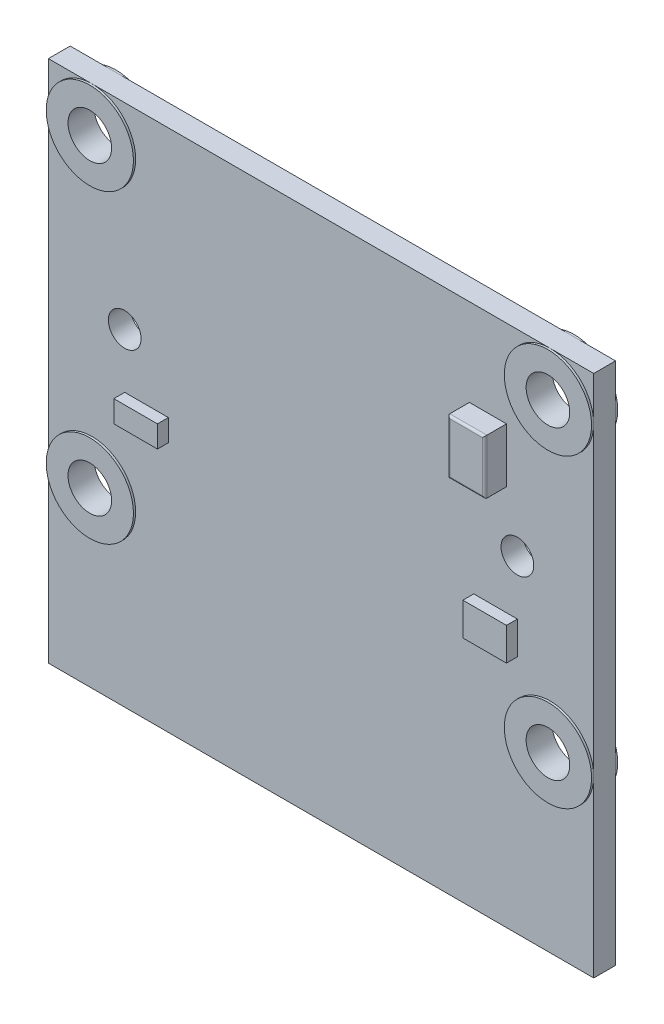
from build123d import *

# Parameters (mm, degrees)
SKETCH1_W                = 25
SKETCH1_H                = 24
BOSS_EXTRUDE1_DEPTH      = 1
SKETCH2_R                = 1
SKETCH2_R_2              = 0.75
CUT_EXTRUDE1_DEPTH       = 2
BOSS_EXTRUDE3_DEPTH      = 0.1
BOSS_EXTRUDE3_DEPTH_BACK = 1.1
SKETCH3_R                = 2
SKETCH3_R_2              = 1
SKETCH4_W                = 1.7
SKETCH4_H                = 2.5
BOSS_EXTRUDE4_DEPTH      = 1
FILLET1_R                = 0.1
SKETCH5_W                = 2
SKETCH5_H                = 1
SKETCH5_H_2              = 1.5
BOSS_EXTRUDE5_DEPTH      = 0.5


with BuildPart() as part:
    # Sketch1 → Boss-Extrude1 (new body)
    with BuildSketch(Plane.XY):
        Rectangle(SKETCH1_W, SKETCH1_H)
    extrude(amount=BOSS_EXTRUDE1_DEPTH)

    # Sketch2 → Cut-Extrude1 (cut)
    with BuildSketch(Plane.XY.offset(1)):
        with Locations((-10.5, 10)):
            Circle(SKETCH2_R)
        with Locations((10.5, 10)):
            Circle(SKETCH2_R)
        with Locations((10.5, -4)):
            Circle(SKETCH2_R)
        with Locations((-10.5, -4)):
            Circle(SKETCH2_R)
        with Locations((-9, 3)):
            Circle(SKETCH2_R_2)
        with Locations((9, 3)):
            Circle(SKETCH2_R_2)
    extrude(amount=-CUT_EXTRUDE1_DEPTH, mode=Mode.SUBTRACT)

    # Sketch3 → Boss-Extrude3 (add, two sides: drawn at the far end of the back side and taken through both)
    # profile 1 of 4: a face of its own
    with BuildSketch(Plane.XY.offset(1).offset(-BOSS_EXTRUDE3_DEPTH_BACK)):
        with Locations((-10.5, 10)):
            Circle(SKETCH3_R)
        with Locations((-10.5, 10)):
            Circle(SKETCH3_R_2, mode=Mode.SUBTRACT)
    # profile 2 of 4: a face of its own
    with BuildSketch(Plane.XY.offset(1).offset(-BOSS_EXTRUDE3_DEPTH_BACK)):
        with Locations((10.5, 10)):
            Circle(SKETCH3_R)
        with Locations((10.5, 10)):
            Circle(SKETCH3_R_2, mode=Mode.SUBTRACT)
    # profile 3 of 4: a face of its own
    with BuildSketch(Plane.XY.offset(1).offset(-BOSS_EXTRUDE3_DEPTH_BACK)):
        with Locations((10.5, -4)):
            Circle(SKETCH3_R)
        with Locations((10.5, -4)):
            Circle(SKETCH3_R_2, mode=Mode.SUBTRACT)
    # profile 4 of 4: a face of its own
    with BuildSketch(Plane.XY.offset(1).offset(-BOSS_EXTRUDE3_DEPTH_BACK)):
        with Locations((-10.5, -4)):
            Circle(SKETCH3_R)
        with Locations((-10.5, -4)):
            Circle(SKETCH3_R_2, mode=Mode.SUBTRACT)
    extrude(amount=BOSS_EXTRUDE3_DEPTH + BOSS_EXTRUDE3_DEPTH_BACK)

    # Sketch4 → Boss-Extrude4 (add)
    with BuildSketch(Plane.XY.offset(1)):
        with Locations((7.65, 6.75)):
            Rectangle(SKETCH4_W, SKETCH4_H)
    extrude(amount=BOSS_EXTRUDE4_DEPTH)

    # Fillet1
    fillet1_edges = [part.edges().sort_by_distance(p)[0] for p in [
        (8.5, 6.75, 2),
        (7.65, 8, 2),
        (6.8, 6.75, 2),
        (7.65, 5.5, 2),
    ]]
    fillet(fillet1_edges, radius=FILLET1_R)

    # Sketch5 → Boss-Extrude5 (add)
    with BuildSketch(Plane.XY.offset(1)):
        with Locations((-8, 0)):
            Rectangle(SKETCH5_W, SKETCH5_H)
        with Locations((8, -0.25)):
            Rectangle(SKETCH5_W, SKETCH5_H_2)
    extrude(amount=BOSS_EXTRUDE5_DEPTH)


solid = part.part
